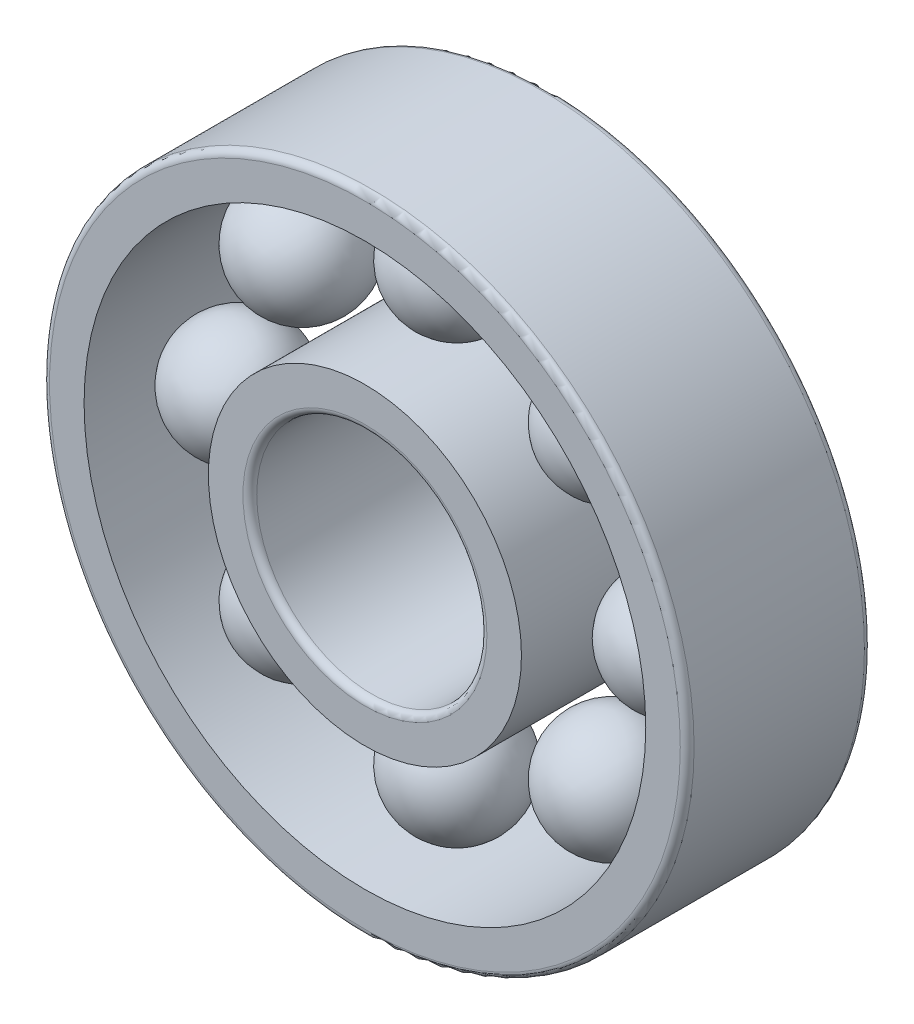
from build123d import *

# Parameters (mm, degrees)
INNERS_W           = 1.8
INNERS_H           = 8
OUTERS_W           = 1.8
OUTERS_H           = 8
BALLSPATTERN_COUNT = 8
FILLET_F1_R        = 0.3
FILLET_F2_R        = 0.3


with BuildPart() as part:
    # InnerS → InnerRing (revolve)
    with BuildSketch(Plane(origin=(0, 0, 0), x_dir=(1, 0, 0), z_dir=(0, 1, 0))):
        with Locations((5.9, 0)):
            Rectangle(INNERS_W, INNERS_H)
    revolve(axis=Axis((0, 0, 7), (0, 0, -1)))

    # Fillet F2
    fillet_f2_edges = [part.edges().sort_by_distance(p)[0] for p in [
        (-5, 0, -4),
        (-5, 0, 4),
    ]]
    fillet(fillet_f2_edges, radius=FILLET_F2_R)


with BuildPart() as body_2:
    # OuterS → OuterRing (revolve)
    with BuildSketch(Plane(origin=(0, 0, 0), x_dir=(1, 0, 0), z_dir=(0, 1, 0))):
        with Locations((13.1, 0)):
            Rectangle(OUTERS_W, OUTERS_H)
    revolve(axis=Axis((0, 0, 7), (0, 0, -1)))

    # Fillet F1
    fillet_f1_edges = [body_2.edges().sort_by_distance(p)[0] for p in [
        (-14, 0, -4),
        (-14, 0, 4),
    ]]
    fillet(fillet_f1_edges, radius=FILLET_F1_R)


with BuildPart() as body_3:
    # BallS → Ball (revolve)
    with BuildSketch(Plane(origin=(0, 0, 0), x_dir=(1, 0, 0), z_dir=(0, 1, 0))):
        with BuildLine():
            Line((6.935, 0), (12.065, 0))
            ThreePointArc((12.065, 0), (9.5, -2.565), (6.935, 0))
        make_face()
    revolve(axis=Axis((6.935, 0, 0), (1, 0, 0)))


with BuildPart() as ballspattern_1:
    # BallsPattern: pattern copy
    add(body_3.part.rotate(Axis((0, 0, -4.4), (0, 0, 1)), 1 * 360 / BALLSPATTERN_COUNT))


with BuildPart() as ballspattern_2:
    # BallsPattern: pattern copy
    add(body_3.part.rotate(Axis((0, 0, -4.4), (0, 0, 1)), 2 * 360 / BALLSPATTERN_COUNT))


with BuildPart() as ballspattern_3:
    # BallsPattern: pattern copy
    add(body_3.part.rotate(Axis((0, 0, -4.4), (0, 0, 1)), 3 * 360 / BALLSPATTERN_COUNT))


with BuildPart() as ballspattern_4:
    # BallsPattern: pattern copy
    add(body_3.part.rotate(Axis((0, 0, -4.4), (0, 0, 1)), 4 * 360 / BALLSPATTERN_COUNT))


with BuildPart() as ballspattern_5:
    # BallsPattern: pattern copy
    add(body_3.part.rotate(Axis((0, 0, -4.4), (0, 0, 1)), 5 * 360 / BALLSPATTERN_COUNT))


with BuildPart() as ballspattern_6:
    # BallsPattern: pattern copy
    add(body_3.part.rotate(Axis((0, 0, -4.4), (0, 0, 1)), 6 * 360 / BALLSPATTERN_COUNT))


with BuildPart() as ballspattern_7:
    # BallsPattern: pattern copy
    add(body_3.part.rotate(Axis((0, 0, -4.4), (0, 0, 1)), 7 * 360 / BALLSPATTERN_COUNT))


solid = Compound([part.part, body_2.part, body_3.part, ballspattern_1.part, ballspattern_2.part, ballspattern_3.part, ballspattern_4.part, ballspattern_5.part, ballspattern_6.part, ballspattern_7.part])
